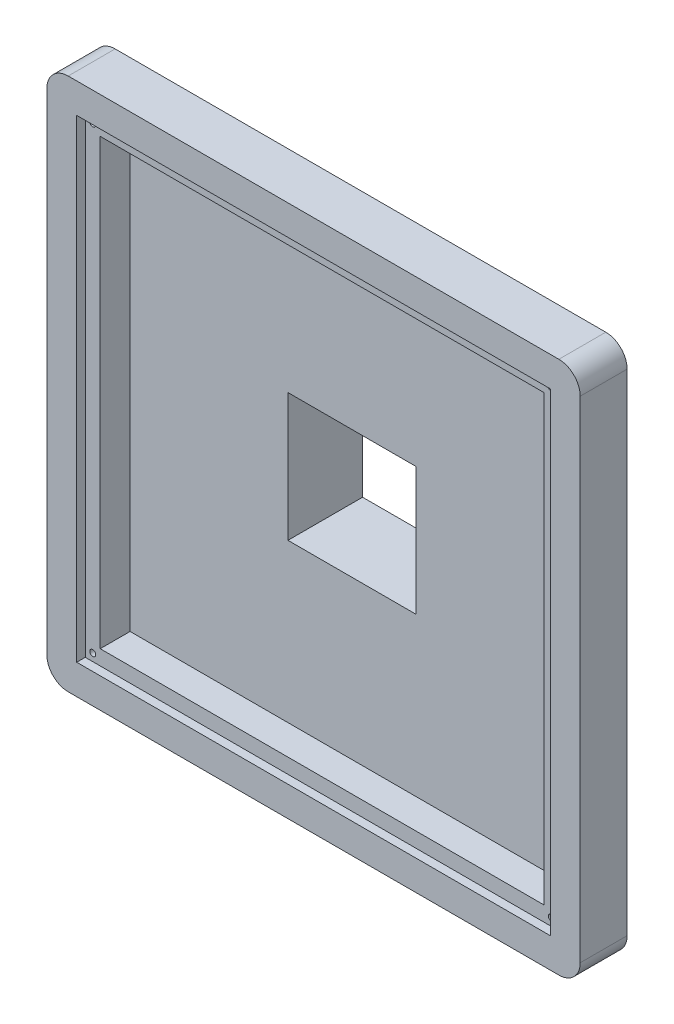
from build123d import *

# Parameters (mm, degrees)
SKETCH1_W               = 63
SKETCH1_H               = 63
BOSS_EXTRUDE1_DEPTH     = 5
SKETCH3_W               = 63
SKETCH3_H               = 63
SKETCH3_W_2             = 60
SKETCH3_H_2             = 60
BOSS_EXTRUDE2_DEPTH     = 16
SKETCH7_W               = 250
SKETCH7_H               = 250
SKETCH7_W_2             = 60
SKETCH7_H_2             = 60
BOSS_EXTRUDE5_DEPTH     = 4
SKETCH9_W               = 250
SKETCH9_H               = 250
SKETCH9_W_2             = 210
SKETCH9_H_2             = 210
BOSS_EXTRUDE6_DEPTH     = 18
SKETCH10_W              = 222
SKETCH10_H              = 222
CUT_EXTRUDE1_DEPTH      = 4
SKETCH14_W              = 210
SKETCH14_H              = 210
SKETCH14_W_2            = 208
SKETCH14_H_2            = 208
BOSS_EXTRUDE9_DEPTH     = 14
SKETCH16_R              = 1.4
CUT_EXTRUDE2_DEPTH      = 10
MIRROR2_COPY_1_SKETCH_R = 1.4
MIRROR2_COPY_1_DEPTH    = 10
FILLET1_R               = 10
FILLET2_R               = 10
FILLET3_R               = 10
FILLET4_R               = 10
SKETCH17_W              = 63
SKETCH17_H              = 63
BOSS_EXTRUDE10_DEPTH    = 10
BOSS_EXTRUDE13_START    = -53
SKETCH18_W              = 69
SKETCH18_H              = 69
SKETCH18_W_2            = 63
SKETCH18_H_2            = 63
BOSS_EXTRUDE13_DEPTH    = 53
SKETCH20_W              = 69
SKETCH20_H              = 69
CUT_EXTRUDE3_DEPTH      = 18
SKETCH21_W              = 60
SKETCH21_H              = 60
CUT_EXTRUDE4_DEPTH      = 232.079018744
SKETCH24_W              = 76
SKETCH24_H              = 76
SKETCH24_W_2            = 69
SKETCH24_H_2            = 69
BOSS_EXTRUDE14_DEPTH    = 31
SKETCH25_R              = 1.4
CUT_EXTRUDE5_DEPTH      = 10
MIRROR4_COPY_1_SKETCH_R = 1.4
MIRROR4_COPY_1_DEPTH    = 10


with BuildPart() as part:
    # Sketch1 → Boss-Extrude1 (new body)
    with BuildSketch(Plane.XY):
        with Locations((-56.732567938, -12.574658475)):
            Rectangle(SKETCH1_W, SKETCH1_H)
    extrude(amount=BOSS_EXTRUDE1_DEPTH)

    # Sketch3 → Boss-Extrude2 (add)
    with BuildSketch(Plane.XY.offset(5)):
        with Locations((-56.732567938, -12.574658475)):
            Rectangle(SKETCH3_W, SKETCH3_H)
        with Locations((-56.732567938, -12.574658475)):
            Rectangle(SKETCH3_W_2, SKETCH3_H_2, mode=Mode.SUBTRACT)
    extrude(amount=BOSS_EXTRUDE2_DEPTH)

    # Sketch7 → Boss-Extrude5 (add)
    with BuildSketch(Plane.XY.offset(21)):
        with Locations((-56.732567938, -12.574658475)):
            Rectangle(SKETCH7_W, SKETCH7_H)
        with Locations((-56.732567938, -12.574658475)):
            Rectangle(SKETCH7_W_2, SKETCH7_H_2, mode=Mode.SUBTRACT)
    extrude(amount=BOSS_EXTRUDE5_DEPTH)

    # Sketch9 → Boss-Extrude6 (add)
    with BuildSketch(Plane.XY.offset(25)):
        with Locations((-56.732567938, -12.574658475)):
            Rectangle(SKETCH9_W, SKETCH9_H)
        with Locations((-56.732567938, -12.574658475)):
            Rectangle(SKETCH9_W_2, SKETCH9_H_2, mode=Mode.SUBTRACT)
    extrude(amount=BOSS_EXTRUDE6_DEPTH)

    # Sketch10 → Cut-Extrude1 (cut)
    with BuildSketch(Plane.XY.offset(43)):
        with Locations((-56.732567938, -12.574658475)):
            Rectangle(SKETCH10_W, SKETCH10_H)
    extrude(amount=-CUT_EXTRUDE1_DEPTH, mode=Mode.SUBTRACT)

    # Sketch14 → Boss-Extrude9 (add)
    with BuildSketch(Plane.XY.offset(25)):
        with Locations((-56.732567938, -12.574658475)):
            Rectangle(SKETCH14_W, SKETCH14_H)
        with Locations((-56.732567938, -12.574658475)):
            Rectangle(SKETCH14_W_2, SKETCH14_H_2, mode=Mode.SUBTRACT)
    extrude(amount=BOSS_EXTRUDE9_DEPTH)

    # Sketch16 → Cut-Extrude2 (cut)
    with BuildSketch(Plane.XY.offset(39)):
        with Locations((50.767432062, -120.074658475)):
            Circle(SKETCH16_R)
    cut_extrude2 = extrude(amount=-CUT_EXTRUDE2_DEPTH, mode=Mode.SUBTRACT)

    # Mirror1: Cut-Extrude2 across plane
    add(cut_extrude2.mirror(Plane(origin=(-56.732567938, 0, 0), x_dir=(0, 0, 1), z_dir=(1, 0, 0))), mode=Mode.SUBTRACT)

    # Mirror2: Cut-Extrude2 across plane
    add(cut_extrude2.mirror(Plane.ZX.offset(-12.574658475)), mode=Mode.SUBTRACT)

    # Mirror2 copy 1 sketch → Mirror2 copy 1 (cut)
    with BuildSketch(Plane(origin=(-113.465135876, -25.149316949, 39), x_dir=(-1, 0, 0), z_dir=(0, 0, 1))):
        with Locations((50.767432062, -120.074658475)):
            Circle(MIRROR2_COPY_1_SKETCH_R)
    extrude(amount=-MIRROR2_COPY_1_DEPTH, mode=Mode.SUBTRACT)

    # Fillet1
    fillet1_edges = [part.edges().sort_by_distance(p)[0] for p in [
        (-181.732567938, 112.425341525, 32),
    ]]
    fillet(fillet1_edges, radius=FILLET1_R)

    # Fillet2
    fillet2_edges = [part.edges().sort_by_distance(p)[0] for p in [
        (-181.732567938, -137.574658475, 32),
    ]]
    fillet(fillet2_edges, radius=FILLET2_R)

    # Fillet3
    fillet3_edges = [part.edges().sort_by_distance(p)[0] for p in [
        (68.267432062, 112.425341525, 32),
    ]]
    fillet(fillet3_edges, radius=FILLET3_R)

    # Fillet4
    fillet4_edges = [part.edges().sort_by_distance(p)[0] for p in [
        (68.267432062, -137.574658475, 32),
    ]]
    fillet(fillet4_edges, radius=FILLET4_R)

    # Sketch17 → Boss-Extrude10 (add)
    with BuildSketch(Plane(origin=(0, 0, 0), x_dir=(-1, 0, 0), z_dir=(0, 0, -1))):
        with Locations((56.732567938, -12.574658475)):
            Rectangle(SKETCH17_W, SKETCH17_H)
    extrude(amount=BOSS_EXTRUDE10_DEPTH)

    # Sketch18 → Boss-Extrude13 (add)
    with BuildSketch(Plane(origin=(0, 0, -10), x_dir=(-1, 0, 0), z_dir=(0, 0, -1)).offset(BOSS_EXTRUDE13_START)):
        with Locations((56.732567938, -12.574658475)):
            Rectangle(SKETCH18_W, SKETCH18_H)
        with Locations((56.732567938, -12.574658475)):
            Rectangle(SKETCH18_W_2, SKETCH18_H_2, mode=Mode.SUBTRACT)
    extrude(amount=BOSS_EXTRUDE13_DEPTH)

    # Sketch20 → Cut-Extrude3 (cut)
    with BuildSketch(Plane.XY.offset(43)):
        with Locations((-56.732567938, -12.574658475)):
            Rectangle(SKETCH20_W, SKETCH20_H)
    extrude(amount=-CUT_EXTRUDE3_DEPTH, mode=Mode.SUBTRACT)

    # Sketch21 → Cut-Extrude4 (cut, through all)
    with BuildSketch(Plane.XY.offset(5)):
        with Locations((-56.732567938, -12.574658475)):
            Rectangle(SKETCH21_W, SKETCH21_H)
    extrude(amount=-CUT_EXTRUDE4_DEPTH, mode=Mode.SUBTRACT)

    # Sketch24 → Boss-Extrude14 (add)
    with BuildSketch(Plane(origin=(0, 0, 21), x_dir=(-1, 0, 0), z_dir=(0, 0, -1))):
        with Locations((56.732567938, -12.574658475)):
            Rectangle(SKETCH24_W, SKETCH24_H)
        with Locations((56.732567938, -12.574658475)):
            Rectangle(SKETCH24_W_2, SKETCH24_H_2, mode=Mode.SUBTRACT)
    extrude(amount=BOSS_EXTRUDE14_DEPTH)

    # Sketch25 → Cut-Extrude5 (cut)
    with BuildSketch(Plane(origin=(0, 0, -10), x_dir=(-1, 0, 0), z_dir=(0, 0, -1))):
        with Locations((90.232567938, 20.925341525)):
            Circle(SKETCH25_R)
    cut_extrude5 = extrude(amount=-CUT_EXTRUDE5_DEPTH, mode=Mode.SUBTRACT)

    # Mirror3: Cut-Extrude5 across plane
    add(cut_extrude5.mirror(Plane.ZX.offset(-12.574658475)), mode=Mode.SUBTRACT)

    # Mirror4: Cut-Extrude5 across plane
    add(cut_extrude5.mirror(Plane.ZY.offset(56.732567938)), mode=Mode.SUBTRACT)

    # Mirror4 copy 1 sketch → Mirror4 copy 1 (cut)
    with BuildSketch(Plane(origin=(-113.465135876, -25.149316949, -10), x_dir=(1, 0, 0), z_dir=(0, 0, -1))):
        with Locations((90.232567938, 20.925341525)):
            Circle(MIRROR4_COPY_1_SKETCH_R)
    extrude(amount=-MIRROR4_COPY_1_DEPTH, mode=Mode.SUBTRACT)


solid = part.part
